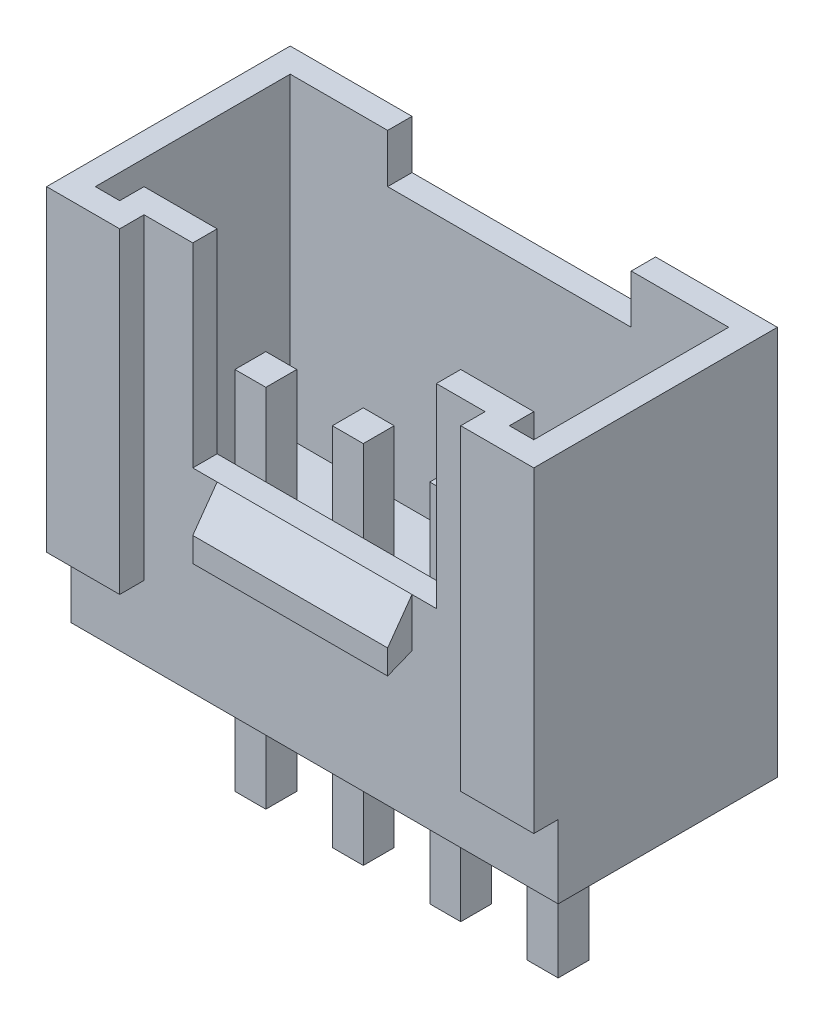
from build123d import *

# Parameters (mm, degrees)
SIDES_DEPTH           = 8
SKETCH2_W             = 5
SKETCH2_H             = 4
FRONT_CUT_DEPTH       = 0.5
BACK_CUT_REACH        = 15.748
SKETCH3_W             = 5
SKETCH3_H             = 1
BASE_DEPTH            = 0.5
PINS_DEPTH            = 4
PINS_DEPTH_BACK       = 3.5
SKETCH4_W             = 0.635
SKETCH4_H             = 0.635
CLIP_DEPTH            = 2
CLIP_DEPTH_BACK       = 2
FRONT_TRIM_DEPTH      = 11.677078252
FRONT_TRIM_DEPTH_BACK = 11.677078252
SKETCH6_W             = 0.5
SKETCH6_H             = 1.5
BOSS_EXTRUDE4_DEPTH   = 1.51


with BuildPart() as part:
    # Sketch1 → Sides (new body)
    with BuildSketch(Plane(origin=(0, 0, 0), x_dir=(1, 0, 0), z_dir=(0, 1, 0))):
        Polygon((8.5, 0), (10, 0), (10, 5), (0, 5), (0, 0), (1.5, 0), (1.5, 0.5), (8.5, 0.5), align=None)
        Polygon((0.5, 4.5), (9.5, 4.5), (9.5, 1.528846154), (9.5, 0.5), (9, 0.5), (9, 1), (1, 1), (1, 0.5), (0.5, 0.5), (0.5, 1.538461538), align=None, mode=Mode.SUBTRACT)
    extrude(amount=SIDES_DEPTH)

    # Sketch2 → Front cut (cut)
    with BuildSketch(Plane.XY.offset(-0.5)):
        with Locations((5, 6)):
            Rectangle(SKETCH2_W, SKETCH2_H)
    extrude(amount=-FRONT_CUT_DEPTH, mode=Mode.SUBTRACT)

    # Sketch3 → Back cut (cut, up to next)
    with BuildSketch(Plane(origin=(0, 0, -5), x_dir=(-1, 0, 0), z_dir=(0, 0, -1)), mode=Mode.PRIVATE) as back_cut_sk1:
        with Locations((-5, 7.5)):
            Rectangle(SKETCH3_W, SKETCH3_H)
    back_cut_tool1 = extrude(back_cut_sk1.sketch, amount=-BACK_CUT_REACH, mode=Mode.PRIVATE) & part.part
    add(back_cut_tool1.solids().sort_by_distance((5, 7.5, -5))[0], mode=Mode.SUBTRACT)

    # Sketch1<2> → Base (add)
    with BuildSketch(Plane(origin=(0, 0, 0), x_dir=(1, 0, 0), z_dir=(0, 1, 0))):
        Polygon((1, 1), (1, 0.5), (0.5, 0.5), (0.5, 1.538461538), (0.5, 4.5), (9.5, 4.5), (9.5, 1.528846154), (9.5, 0.5), (9, 0.5), (9, 1), align=None)
    extrude(amount=BASE_DEPTH)

    # Sketch4 → Pins (add, two sides: drawn at the far end of the back side and taken through both)
    with BuildSketch(Plane(origin=(0, 0.5, 0), x_dir=(1, 0, 0), z_dir=(0, 1, 0)).offset(-PINS_DEPTH_BACK)):
        with Locations((2, 2.5)):
            Rectangle(SKETCH4_W, SKETCH4_H)
        with Locations((4, 2.5)):
            Rectangle(SKETCH4_W, SKETCH4_H)
        with Locations((6, 2.5)):
            Rectangle(SKETCH4_W, SKETCH4_H)
        with Locations((8, 2.5)):
            Rectangle(SKETCH4_W, SKETCH4_H)
    extrude(amount=PINS_DEPTH + PINS_DEPTH_BACK)

    # Sketch5 → Clip (add, two sides: drawn at the far end of the back side and taken through both)
    with BuildSketch(Plane(origin=(5, 0, 0), x_dir=(0, 0, -1), z_dir=(1, 0, 0)).offset(-CLIP_DEPTH_BACK)):
        Polygon((0.5, 4), (0.5, 3), (0, 2.8), (0, 3.3), align=None)
    extrude(amount=CLIP_DEPTH + CLIP_DEPTH_BACK)

    # Sketch6 → Front trim (cut, two sides: drawn at the far end of the back side and taken through both)
    with BuildSketch(Plane(origin=(5, 0, 0), x_dir=(0, 0, -1), z_dir=(1, 0, 0)).offset(-FRONT_TRIM_DEPTH_BACK)):
        with Locations((0.25, 0.75)):
            Rectangle(SKETCH6_W, SKETCH6_H)
    extrude(amount=FRONT_TRIM_DEPTH + FRONT_TRIM_DEPTH_BACK, mode=Mode.SUBTRACT)

    # Sketch1<4> → Boss-Extrude4 (add)
    with BuildSketch(Plane(origin=(0, 0, 0), x_dir=(1, 0, 0), z_dir=(0, 1, 0))):
        Polygon((1, 1), (1, 0.5), (0.5, 0.5), (0.5, 1.538461538), (0.5, 4.5), (9.5, 4.5), (9.5, 1.528846154), (9.5, 0.5), (9, 0.5), (9, 1), align=None)
    extrude(amount=BOSS_EXTRUDE4_DEPTH)


solid = part.part
